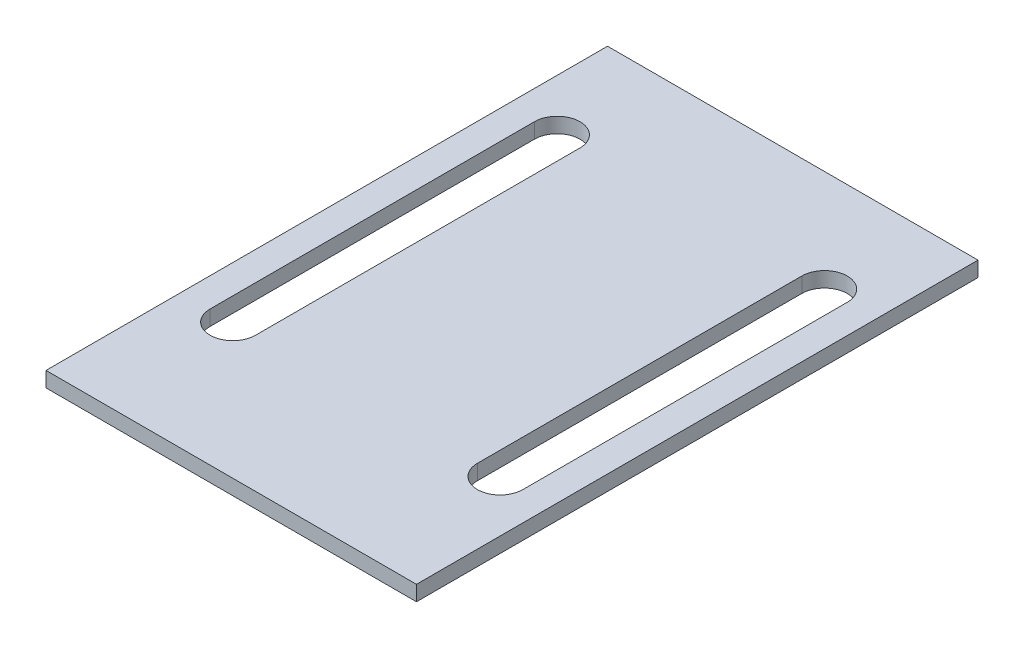
from build123d import *

# Parameters (mm, degrees)
SKETCH1_W           = 122.1
SKETCH1_H           = 197.8
BOSS_EXTRUDE2_DEPTH = 5
CUT_EXTRUDE1_DEPTH  = 5
SKETCH5_W           = 176.692600263
SKETCH5_H           = 67.834694549
CUT_EXTRUDE2_DEPTH  = 12
SKETCH6_W           = 148.50335492
SKETCH6_H           = 63.858757444
CUT_EXTRUDE3_DEPTH  = 19
SKETCH10_W          = 122.1
SKETCH10_H          = 5
BOSS_EXTRUDE4_DEPTH = 18.27


with BuildPart() as part:
    # Sketch1 → Boss-Extrude2 (new body)
    with BuildSketch(Plane(origin=(0, 0, 0), x_dir=(1, 0, 0), z_dir=(0, 1, 0))):
        with Locations((61.05, 98.9)):
            Rectangle(SKETCH1_W, SKETCH1_H)
    extrude(amount=BOSS_EXTRUDE2_DEPTH)

    # Sketch3 → Cut-Extrude1 (cut)
    with BuildSketch(Plane(origin=(0, 5, 0), x_dir=(1, 0, 0), z_dir=(0, 1, 0))):
        with BuildLine():
            Line((24.5, 45.30156802), (24.5, 152.22156802))
            ThreePointArc((24.5, 152.22156802), (17, 159.72156802), (9.5, 152.22156802))
            Line((9.5, 152.22156802), (9.5, 45.30156802))
            ThreePointArc((9.5, 45.30156802), (17, 37.80156802), (24.5, 45.30156802))
        make_face()
        with BuildLine():
            ThreePointArc((112.6, 152.22156802), (105.1, 159.72156802), (97.6, 152.22156802))
            Line((97.6, 152.22156802), (97.6, 45.30156802))
            ThreePointArc((97.6, 45.30156802), (105.1, 37.80156802), (112.6, 45.30156802))
            Line((112.6, 45.30156802), (112.6, 152.22156802))
        make_face()
    extrude(amount=-CUT_EXTRUDE1_DEPTH, mode=Mode.SUBTRACT)

    # Sketch5 → Cut-Extrude2 (cut)
    with BuildSketch(Plane(origin=(0, 0, -197.8), x_dir=(-1, 0, 0), z_dir=(0, 0, -1))):
        with Locations((-46.708276043, -7.602787765)):
            Rectangle(SKETCH5_W, SKETCH5_H)
    extrude(amount=-CUT_EXTRUDE2_DEPTH, mode=Mode.SUBTRACT)

    # Sketch6 → Cut-Extrude3 (cut)
    with BuildSketch(Plane.XY):
        with Locations((68.056552209, 0.930489014)):
            Rectangle(SKETCH6_W, SKETCH6_H)
    extrude(amount=-CUT_EXTRUDE3_DEPTH, mode=Mode.SUBTRACT)

    # Sketch10 → Boss-Extrude4 (add)
    with BuildSketch(Plane.XY.offset(-19)):
        with Locations((61.05, 2.5)):
            Rectangle(SKETCH10_W, SKETCH10_H)
    extrude(amount=BOSS_EXTRUDE4_DEPTH)


solid = part.part
